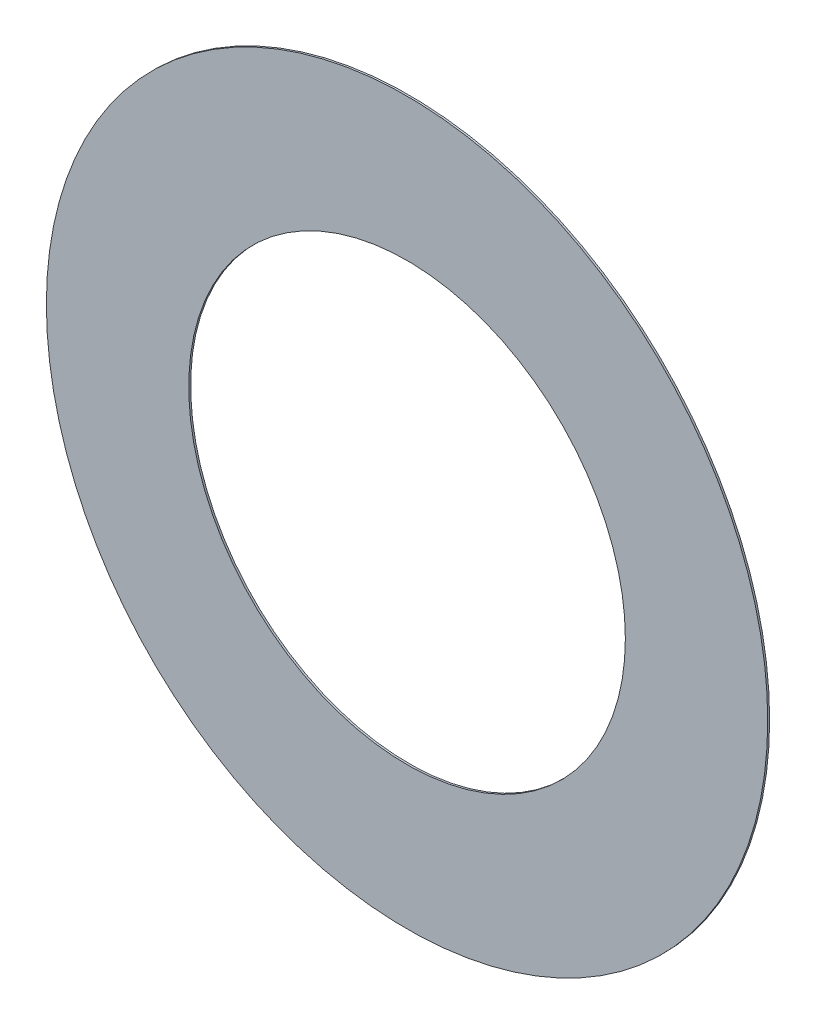
from build123d import *

# Parameters (mm, degrees)
SKETCH1_R      = 19
SKETCH1_R_2    = 11.5
EXTRUDE1_DEPTH = 0.1


with BuildPart() as part:
    # Sketch1 → Extrude1 (new body)
    with BuildSketch(Plane.XY):
        with Locations((-57.16, 27)):
            Circle(SKETCH1_R)
        with Locations((-57.16, 27)):
            Circle(SKETCH1_R_2, mode=Mode.SUBTRACT)
    extrude(amount=EXTRUDE1_DEPTH)


solid = part.part
